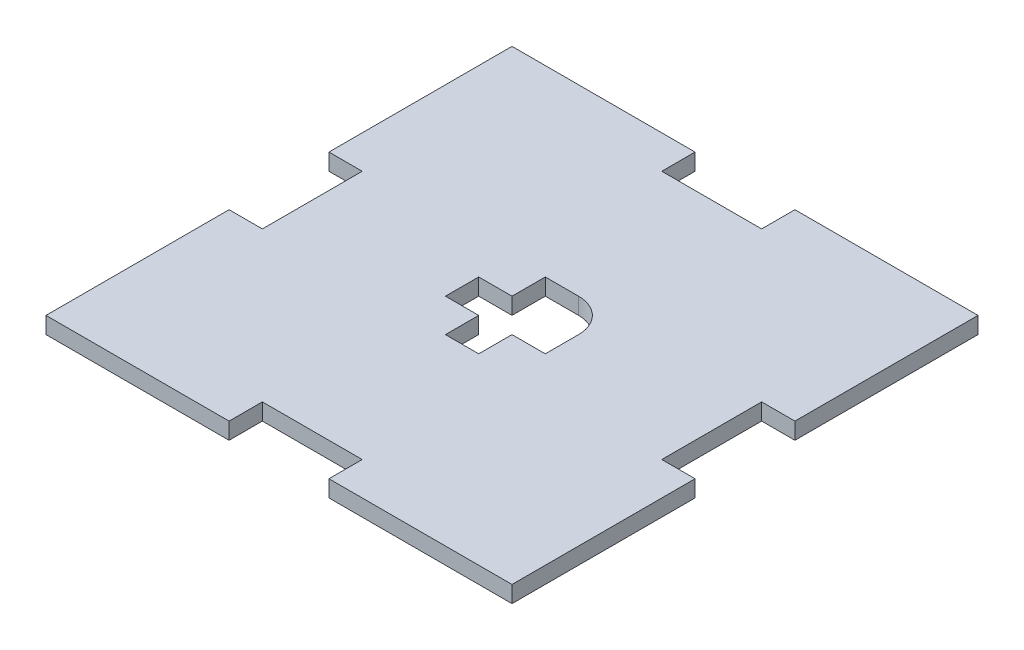
from build123d import *

# Parameters (mm, degrees)
SKETCH1_W           = 88.9
SKETCH1_H           = 88.9
BOSS_EXTRUDE1_DEPTH = 3.175
CUT_EXTRUDE3_DEPTH  = 3.175
SKETCH4_W           = 19.05
SKETCH4_H           = 6.35
SKETCH4_W_2         = 6.35
SKETCH4_H_2         = 19.05
CUT_EXTRUDE2_DEPTH  = 3.175
SKETCH7_W           = 6.35
SKETCH7_H           = 6.35
CUT_EXTRUDE4_DEPTH  = 126.763669734
FILLET1_R           = 6.35


with BuildPart() as part:
    # Sketch1 → Boss-Extrude1 (new body)
    with BuildSketch(Plane(origin=(0, 0, 0), x_dir=(1, 0, 0), z_dir=(0, 1, 0))):
        with Locations((44.45, 44.45)):
            Rectangle(SKETCH1_W, SKETCH1_H)
    extrude(amount=BOSS_EXTRUDE1_DEPTH)

    # Sketch5 → Cut-Extrude3 (cut)
    with BuildSketch(Plane(origin=(0, 3.175, 0), x_dir=(1, 0, 0), z_dir=(0, 1, 0))):
        Polygon((41.275, 47.625), (41.275, 53.975), (47.625, 53.975), (47.625, 47.625), (53.975, 47.625), (53.975, 41.275), (47.625, 41.275), (47.625, 34.925), (41.275, 34.925), (41.275, 41.275), (34.925, 41.275), (34.925, 47.625), align=None)
    extrude(amount=-CUT_EXTRUDE3_DEPTH, mode=Mode.SUBTRACT)

    # Sketch4 → Cut-Extrude2 (cut)
    with BuildSketch(Plane(origin=(0, 3.175, 0), x_dir=(1, 0, 0), z_dir=(0, 1, 0))):
        with Locations((44.45, 85.725)):
            Rectangle(SKETCH4_W, SKETCH4_H)
        with Locations((85.725, 44.45)):
            Rectangle(SKETCH4_W_2, SKETCH4_H_2)
        with Locations((44.45, 3.175)):
            Rectangle(SKETCH4_W, SKETCH4_H)
        with Locations((3.175, 44.45)):
            Rectangle(SKETCH4_W_2, SKETCH4_H_2)
    extrude(amount=-CUT_EXTRUDE2_DEPTH, mode=Mode.SUBTRACT)

    # Sketch7 → Cut-Extrude4 (cut, through all)
    with BuildSketch(Plane(origin=(0, 3.175, 0), x_dir=(1, 0, 0), z_dir=(0, 1, 0))):
        with Locations((50.8, 50.8)):
            Rectangle(SKETCH7_W, SKETCH7_H)
    extrude(amount=-CUT_EXTRUDE4_DEPTH, mode=Mode.SUBTRACT)

    # Fillet1
    fillet1_edges = [part.edges().sort_by_distance(p)[0] for p in [
        (53.975, 1.5875, -53.975),
    ]]
    fillet(fillet1_edges, radius=FILLET1_R)


solid = part.part
